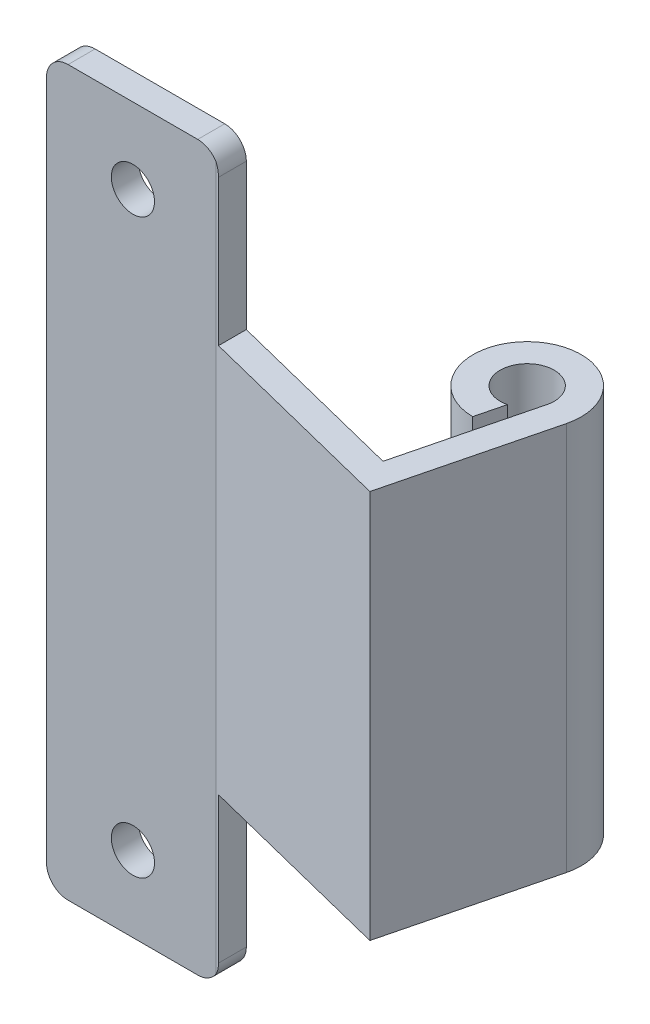
from build123d import *

# Parameters (mm, degrees)
BOSS_EXTRUDE1_DEPTH     = 33.5
CUT_EXTRUDE1_DEPTH      = 50.262054362
CUT_EXTRUDE1_DEPTH_BACK = 50.262054362
SKETCH3_W               = 37.712944555
SKETCH3_H               = 32.806463902
SKETCH4_R               = 2
CUT_EXTRUDE2_DEPTH      = 50.262054362
FILLET1_R               = 2


with BuildPart() as part:
    # Sketch1 → Boss-Extrude1 (new, symmetric)
    with BuildSketch(Plane(origin=(0, 0, 0), x_dir=(1, 0, 0), z_dir=(0, 1, 0))):
        with BuildLine():
            Line((4.849945859, -1.215740583), (1.202724111, -15.76557816))
            Line((1.202724111, -15.76557816), (-17.808565296, -11))
            Line((-17.808565296, -11), (-33.5, -11))
            Line((-33.5, -11), (-33.5, -8.5))
            Line((-33.5, -8.5), (-17.5, -8.5))
            Line((-17.5, -8.5), (-0.614378527, -12.732734939))
            Line((-0.614378527, -12.732734939), (2.42497293, -0.607870291))
            ThreePointArc((2.42497293, -0.607870291), (-1.76517118, 1.77035892), (0.600751286, -2.426746359))
            Line((0.600751286, -2.426746359), (-0.044239613, -4.999804282))
            ThreePointArc((-0.044239613, -4.999804282), (-3.058347209, 3.95556726), (4.849945859, -1.215740583))
        make_face()
    extrude(amount=BOSS_EXTRUDE1_DEPTH, both=True)

    # Sketch3 → Cut-Extrude1 (cut, two sides: drawn at the far end of the back side and taken through both)
    with BuildSketch(Plane(origin=(0, 0, 8.5), x_dir=(-1, 0, 0), z_dir=(0, 0, -1)).offset(-CUT_EXTRUDE1_DEPTH_BACK)):
        with Locations((-1.356472277, 34.403231951)):
            Rectangle(SKETCH3_W, SKETCH3_H)
        with Locations((-1.356472277, -34.403231951)):
            Rectangle(SKETCH3_W, SKETCH3_H)
    extrude(amount=CUT_EXTRUDE1_DEPTH + CUT_EXTRUDE1_DEPTH_BACK, mode=Mode.SUBTRACT)

    # Sketch4 → Cut-Extrude2 (cut, through all)
    with BuildSketch(Plane(origin=(0, 0, 8.5), x_dir=(-1, 0, 0), z_dir=(0, 0, -1))):
        with Locations((25.5, 26.5)):
            Circle(SKETCH4_R)
        with Locations((25.5, -26.5)):
            Circle(SKETCH4_R)
    extrude(amount=-CUT_EXTRUDE2_DEPTH, mode=Mode.SUBTRACT)

    # Fillet1
    fillet1_edges = [part.edges().sort_by_distance(p)[0] for p in [
        (-17.5, -33.5, 9.788674179),
        (-33.5, -33.5, 9.75),
        (-33.5, 33.5, 9.75),
        (-17.5, 33.5, 9.788674179),
    ]]
    fillet(fillet1_edges, radius=FILLET1_R)


solid = part.part
